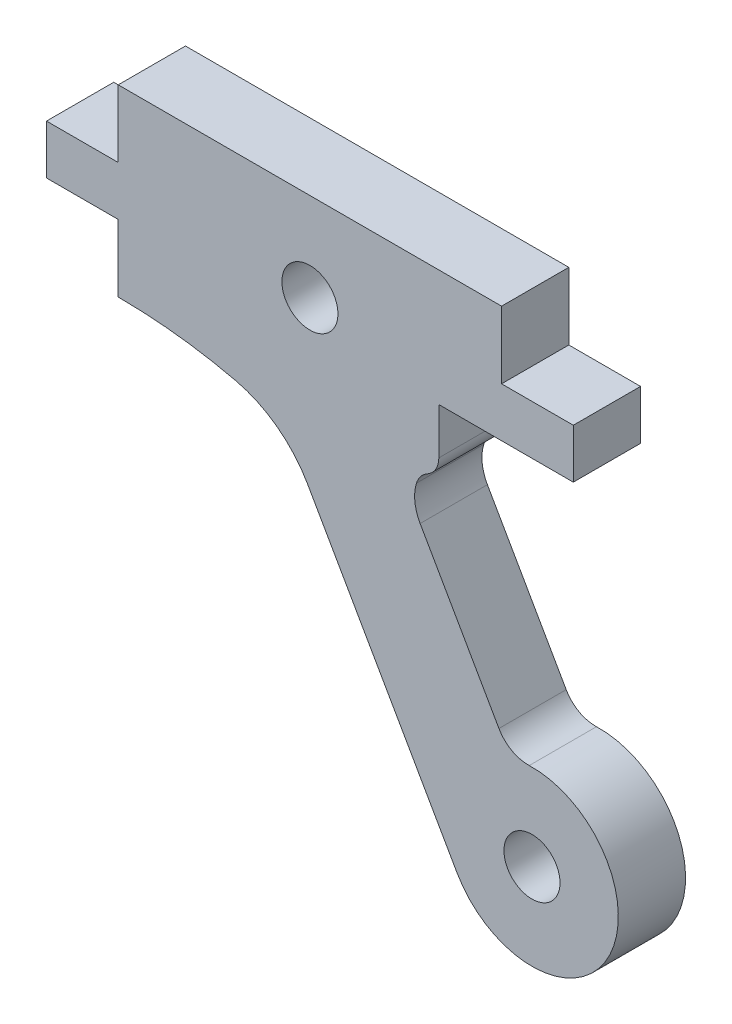
from build123d import *

# Parameters (mm, degrees)
SKETCH1_R           = 1.25
BOSS_EXTRUDE1_DEPTH = 3


with BuildPart() as part:
    # Sketch1 → Boss-Extrude1 (new body)
    with BuildSketch(Plane.XY):
        with BuildLine():
            Line((-8.55, 3.95), (-8.55, 0.95))
            Line((-8.55, 0.95), (-11.75, 0.95))
            Line((-11.75, 0.95), (-11.75, -1.25))
            Line((-11.75, -1.25), (-8.55, -1.25))
            Line((-8.55, -1.25), (-8.55, -4.25))
            ThreePointArc((-8.55, -4.25), (-5.910428138, -4.402345457), (-3.30591057, -4.857358634))
            ThreePointArc((-3.30591057, -4.857358634), (-1.454878683, -5.719893), (-0.102452292, -7.25))
            Line((-0.102452292, -7.25), (6.562981761, -18.935153937))
            ThreePointArc((6.562981761, -18.935153937), (13.267003018, -18.907466339), (9.783368802, -13.179555702))
            ThreePointArc((9.783368802, -13.179555702), (9.002704868, -12.989356806), (8.432203134, -12.423548032))
            Line((8.432203134, -12.423548032), (4.917797703, -6.262453627))
            ThreePointArc((4.917797703, -6.262453627), (4.683242695, -5.539245875), (4.756045532, -4.782446528))
            ThreePointArc((4.756045532, -4.782446528), (4.940606931, -4.436565895), (5.240042816, -4.18351556))
            ThreePointArc((5.240042816, -4.18351556), (5.613146226, -3.816771245), (5.75, -3.311817195))
            Line((5.75, -3.311817195), (5.75, -1.25))
            Line((5.75, -1.25), (11.75, -1.25))
            Line((11.75, -1.25), (11.75, 0.95))
            Line((11.75, 0.95), (8.55, 0.95))
            Line((8.55, 0.95), (8.55, 3.95))
            Line((8.55, 3.95), (-8.55, 3.95))
        make_face()
        with Locations((9.907171224, -17.027564663)):
            Circle(SKETCH1_R, mode=Mode.SUBTRACT)
        Circle(SKETCH1_R, mode=Mode.SUBTRACT)
    extrude(amount=BOSS_EXTRUDE1_DEPTH)


solid = part.part
